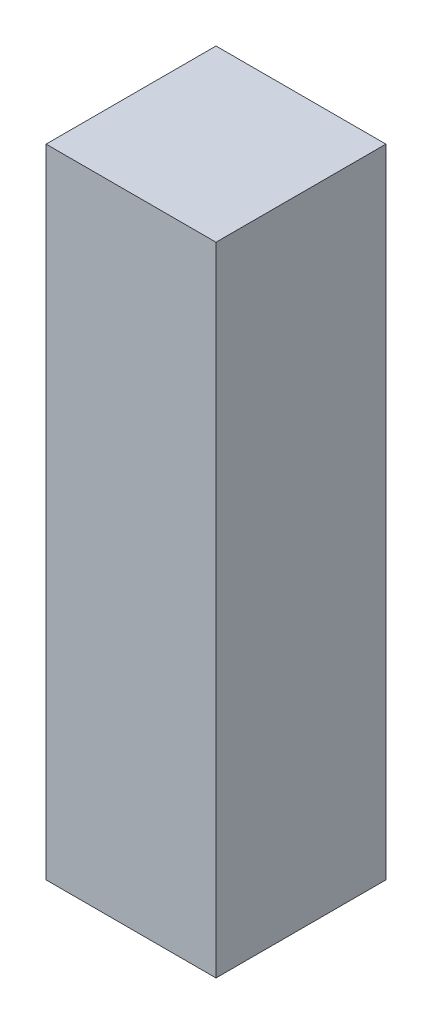
from build123d import *

# Parameters (mm, degrees)
SKETCH2_W           = 8
SKETCH2_H           = 8
BOSS_EXTRUDE1_DEPTH = 30


with BuildPart() as part:
    # Sketch2 → Boss-Extrude1 (new body)
    with BuildSketch(Plane(origin=(0, 0, 0), x_dir=(1, 0, 0), z_dir=(0, 1, 0))):
        Rectangle(SKETCH2_W, SKETCH2_H)
    extrude(amount=BOSS_EXTRUDE1_DEPTH)


solid = part.part
